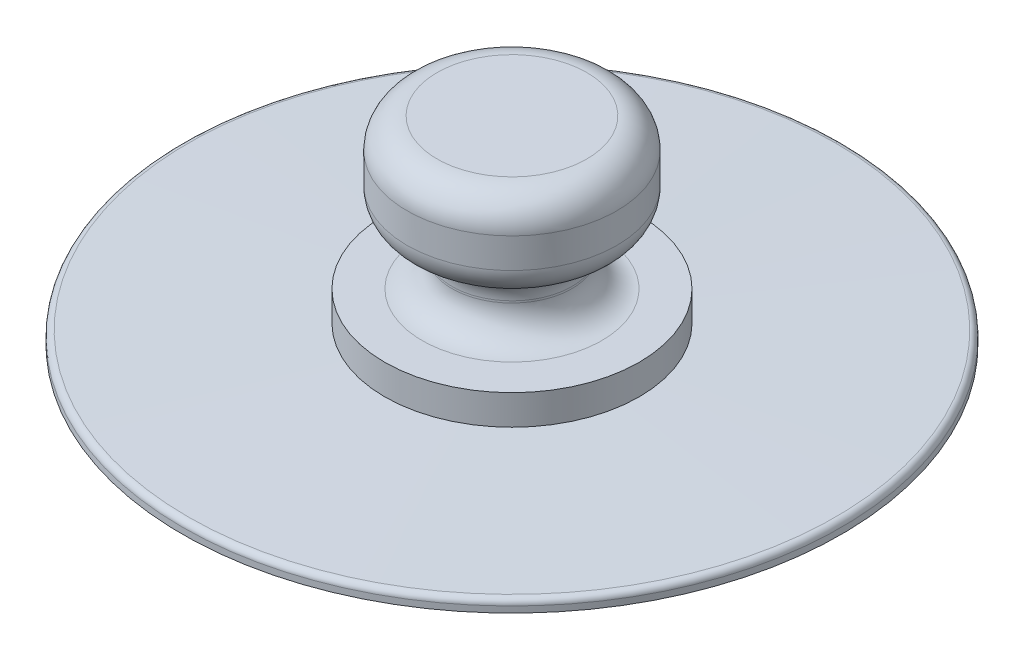
from build123d import *

# Parameters (mm, degrees)
FILLET1_R = 1
FILLET2_R = 1
FILLET3_R = 0.2


with BuildPart() as part:
    # Sketch1 → Revolve1 (revolve)
    with BuildSketch(Plane(origin=(0, 0, 0), x_dir=(0, 0, -1), z_dir=(1, 0, 0)), mode=Mode.PRIVATE) as revolve1_sk:
        Polygon((-11, 0), (-10, 0), (0, 0.1), (0, 6.6), (-3.5, 6.6), (-3.5, 3.6), (-2, 3.6), (-2, 1.6), (-4.25, 1.6), (-4.25, 0.6), (-11, 0.4), align=None)
    revolve(revolve1_sk.sketch.rotate(Axis((0, 0, 0), (0, 1, 0)), 180), axis=Axis((0, 0, 0), (0, 1, 0)))

    # Fillet1
    fillet1_edges = [part.edges().sort_by_distance(p)[0] for p in [
        (0, 6.6, 3.5),
        (0, 3.6, 3.5),
    ]]
    fillet(fillet1_edges, radius=FILLET1_R)

    # Fillet2
    fillet2_edges = [part.edges().sort_by_distance(p)[0] for p in [
        (0, 1.6, 2),
        (0, 3.6, 2),
    ]]
    fillet(fillet2_edges, radius=FILLET2_R)

    # Fillet3
    fillet3_edges = [part.edges().sort_by_distance(p)[0] for p in [
        (0, 0.4, 11),
    ]]
    fillet(fillet3_edges, radius=FILLET3_R)


solid = part.part
